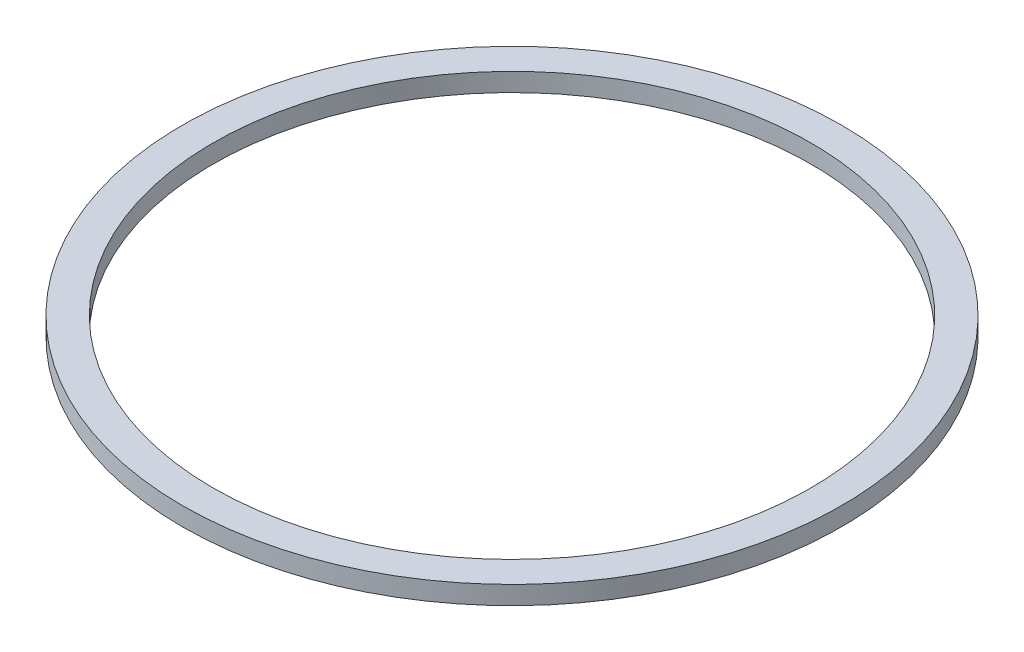
from build123d import *

# Parameters (mm, degrees)
SKETCH_1_R      = 21.5
SKETCH_1_R_2    = 19.5
EXTRUDE_1_DEPTH = 1.2


with BuildPart() as part:
    # 草图1 → 凸台-拉伸1 (new body)
    with BuildSketch(Plane(origin=(0, 0, 0), x_dir=(1, 0, 0), z_dir=(0, 1, 0))):
        with Locations(Location((0, 0, 0), (0, 0, 270))):
            Circle(SKETCH_1_R)
        with Locations(Location((0, 0, 0), (0, 0, 270))):
            Circle(SKETCH_1_R_2, mode=Mode.SUBTRACT)
    extrude(amount=EXTRUDE_1_DEPTH)


solid = part.part
